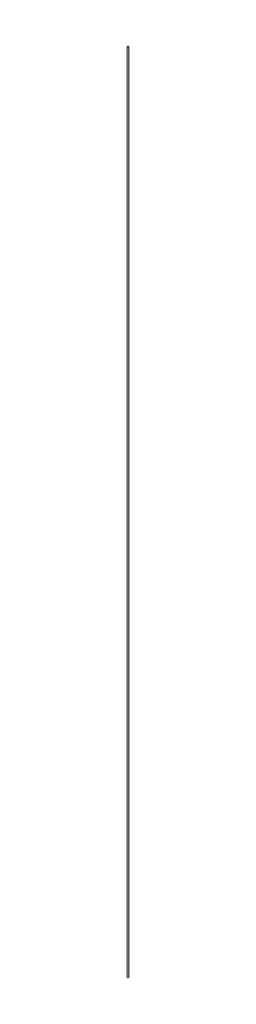
from build123d import *

# Parameters (mm, degrees)
SWEEP1_PROFILE_R = 6.35


with BuildPart() as part:
    # Sweep1: sweep along a path in Sketch1
    with BuildLine(Plane.XY) as sweep1_path:
        Line((0, 0), (0, 8812.784))
    # Sweep1 profile (on start of the path) → Sweep1 (sweep)
    with BuildSketch(Plane.ZX):
        Circle(SWEEP1_PROFILE_R)
    sweep(path=sweep1_path.line)


solid = part.part
